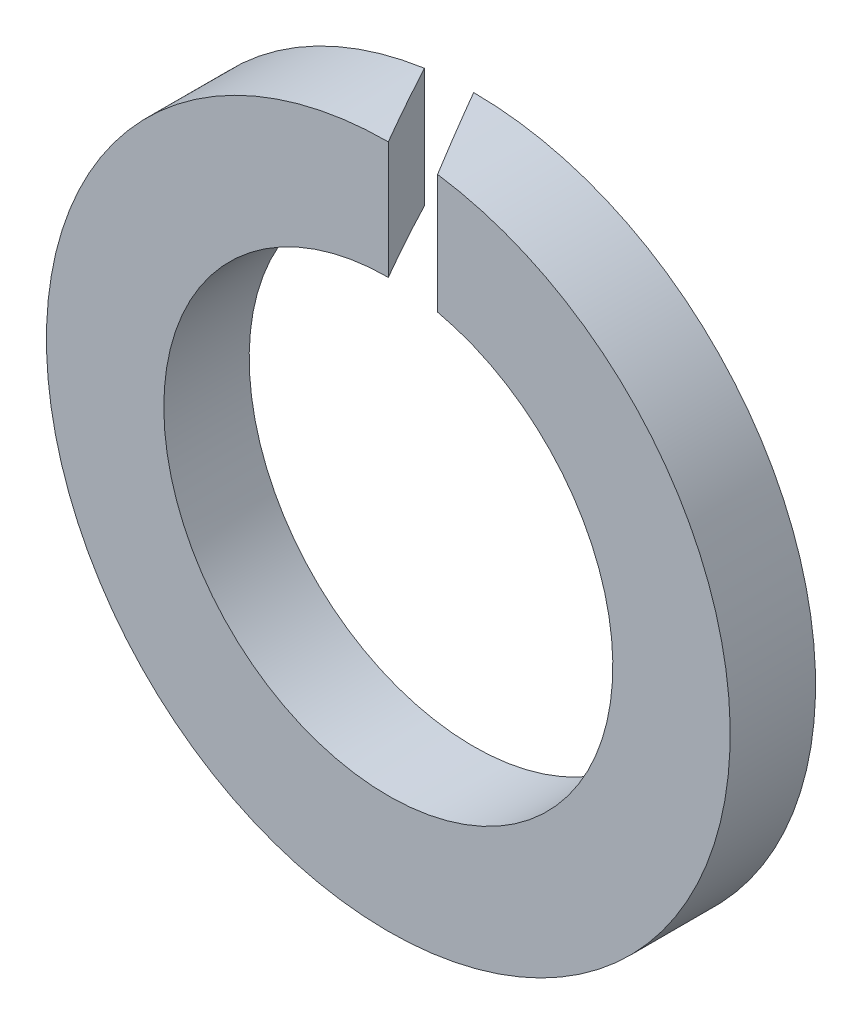
from build123d import *

# Parameters (mm, degrees)
SKETCH_1_W          = 16.02
SKETCH_1_H          = 4
CUT_EXTRUDE_1_DEPTH = 24.006103538
DRAFT_1_ANGLE       = -30
DRAFT_2_ANGLE       = 30
SKETCH_3_W          = 10.52
SKETCH_3_H          = 4


with BuildPart() as part:
    # 草图1 → 旋转1 (revolve)
    with BuildSketch(Plane(origin=(0, 0, 0), x_dir=(1, 0, 0), z_dir=(0, 1, 0))):
        with Locations((8.01, 2)):
            Rectangle(SKETCH_1_W, SKETCH_1_H)
    revolve(axis=Axis((0, 0, -4), (0, 0, 1)))

    # 草图2 → 切除-拉伸1 (cut, through all)
    with BuildSketch(Plane.XY):
        with BuildLine():
            Line((0, 16.02), (0, 10.52))
            ThreePointArc((0, 10.52), (1.16180729, 10.455649373), (2.309401077, 10.263384757))
            Line((2.309401077, 10.263384757), (2.309401077, 15.852667494))
            ThreePointArc((2.309401077, 15.852667494), (1.157727677, 15.978112111), (0, 16.02))
        make_face()
    extrude(amount=-CUT_EXTRUDE_1_DEPTH, mode=Mode.SUBTRACT)

    # 拔模1
    draft_1_faces = [part.faces().sort_by_distance(p)[0] for p in [
        (0, 13.27, -2),
    ]]
    draft(draft_1_faces, Plane.XY, DRAFT_1_ANGLE)

    # 拔模2
    draft_2_faces = [part.faces().sort_by_distance(p)[0] for p in [
        (2.309401077, 13.058026125, -2),
    ]]
    draft(draft_2_faces, Plane.XY, DRAFT_2_ANGLE)

    # 草图3 → 切除-旋转1 (revolve, cut)
    with BuildSketch(Plane.XZ):
        with Locations((5.26, -2)):
            Rectangle(SKETCH_3_W, SKETCH_3_H)
    revolve(axis=Axis((0, 0, 0), (0, 0, -1)), mode=Mode.SUBTRACT)


solid = part.part
